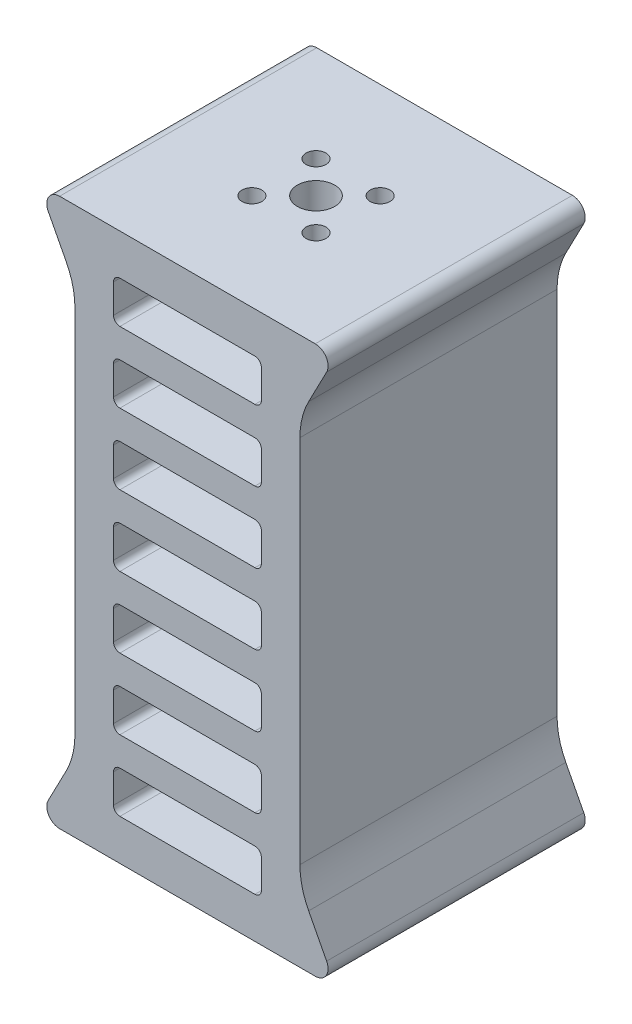
from build123d import *

# Parameters (mm, degrees)
BOSS_EXTRUDE1_DEPTH      = 20
BOSS_EXTRUDE1_DEPTH_BACK = 20
SKETCH1_W                = 35
SKETCH1_H                = 85.2
CUT_EXTRUDE2_REACH       = 91.478
SKETCH5_R                = 1.55
SKETCH5_R_2              = 2.9
CUT_EXTRUDE3_DEPTH       = 8
BOSS_EXTRUDE2_DEPTH      = 40


with BuildPart() as part:
    # Sketch1 → Boss-Extrude1 (new, two sides: drawn at the far end of the back side and taken through both)
    with BuildSketch(Plane.XY.offset(-BOSS_EXTRUDE1_DEPTH_BACK)):
        with Locations((1.938408795, -35.043181818)):
            Rectangle(SKETCH1_W, SKETCH1_H)
    extrude(amount=BOSS_EXTRUDE1_DEPTH + BOSS_EXTRUDE1_DEPTH_BACK)

    # Sketch2 → Cut-Extrude2 (cut, up to next)
    with BuildSketch(Plane.XY.offset(20), mode=Mode.PRIVATE) as cut_extrude2_sk1:
        with BuildLine():
            Line((-9.561591205, -10.793181818), (-9.561591205, -15.293181818))
            ThreePointArc((-9.561591205, -15.293181818), (-9.268697986, -16.000288599), (-8.561591205, -16.293181818))
            Line((-8.561591205, -16.293181818), (12.438408795, -16.293181818))
            ThreePointArc((12.438408795, -16.293181818), (13.145515577, -16.000288599), (13.438408795, -15.293181818))
            Line((13.438408795, -15.293181818), (13.438408795, -10.793181818))
            ThreePointArc((13.438408795, -10.793181818), (13.145515577, -10.086075037), (12.438408795, -9.793181818))
            Line((12.438408795, -9.793181818), (-8.561591205, -9.793181818))
            ThreePointArc((-8.561591205, -9.793181818), (-9.268697986, -10.086075037), (-9.561591205, -10.793181818))
        make_face()
    cut_extrude2_tool1 = extrude(cut_extrude2_sk1.sketch, amount=-CUT_EXTRUDE2_REACH, mode=Mode.PRIVATE) & part.part
    # Sketch2 → Cut-Extrude2 (cut, up to next)
    with BuildSketch(Plane.XY.offset(20), mode=Mode.PRIVATE) as cut_extrude2_sk2:
        with BuildLine():
            Line((-9.561591205, -21.793181818), (-9.561591205, -26.293181818))
            ThreePointArc((-9.561591205, -26.293181818), (-9.268697986, -27.000288599), (-8.561591205, -27.293181818))
            Line((-8.561591205, -27.293181818), (12.438408795, -27.293181818))
            ThreePointArc((12.438408795, -27.293181818), (13.145515577, -27.000288599), (13.438408795, -26.293181818))
            Line((13.438408795, -26.293181818), (13.438408795, -21.793181818))
            ThreePointArc((13.438408795, -21.793181818), (13.145515577, -21.086075037), (12.438408795, -20.793181818))
            Line((12.438408795, -20.793181818), (-8.561591205, -20.793181818))
            ThreePointArc((-8.561591205, -20.793181818), (-9.268697986, -21.086075037), (-9.561591205, -21.793181818))
        make_face()
    cut_extrude2_tool2 = extrude(cut_extrude2_sk2.sketch, amount=-CUT_EXTRUDE2_REACH, mode=Mode.PRIVATE) & part.part
    # Sketch2 → Cut-Extrude2 (cut, up to next)
    with BuildSketch(Plane.XY.offset(20), mode=Mode.PRIVATE) as cut_extrude2_sk3:
        with BuildLine():
            Line((-8.561591205, 1.206818182), (12.438408795, 1.206818182))
            ThreePointArc((12.438408795, 1.206818182), (13.145515577, 0.913924963), (13.438408795, 0.206818182))
            Line((13.438408795, 0.206818182), (13.438408795, -4.293181818))
            ThreePointArc((13.438408795, -4.293181818), (13.145515577, -5.000288599), (12.438408795, -5.293181818))
            Line((12.438408795, -5.293181818), (-8.561591205, -5.293181818))
            ThreePointArc((-8.561591205, -5.293181818), (-9.268697986, -5.000288599), (-9.561591205, -4.293181818))
            Line((-9.561591205, -4.293181818), (-9.561591205, 0.206818182))
            ThreePointArc((-9.561591205, 0.206818182), (-9.268697986, 0.913924963), (-8.561591205, 1.206818182))
        make_face()
    cut_extrude2_tool3 = extrude(cut_extrude2_sk3.sketch, amount=-CUT_EXTRUDE2_REACH, mode=Mode.PRIVATE) & part.part
    # Sketch2 → Cut-Extrude2 (cut, up to next)
    with BuildSketch(Plane.XY.offset(20), mode=Mode.PRIVATE) as cut_extrude2_sk4:
        with BuildLine():
            Line((-9.561591205, -32.793181818), (-9.561591205, -37.293181818))
            ThreePointArc((-9.561591205, -37.293181818), (-9.268697986, -38.000288599), (-8.561591205, -38.293181818))
            Line((-8.561591205, -38.293181818), (12.438408795, -38.293181818))
            ThreePointArc((12.438408795, -38.293181818), (13.145515577, -38.000288599), (13.438408795, -37.293181818))
            Line((13.438408795, -37.293181818), (13.438408795, -32.793181818))
            ThreePointArc((13.438408795, -32.793181818), (13.145515577, -32.086075037), (12.438408795, -31.793181818))
            Line((12.438408795, -31.793181818), (-8.561591205, -31.793181818))
            ThreePointArc((-8.561591205, -31.793181818), (-9.268697986, -32.086075037), (-9.561591205, -32.793181818))
        make_face()
    cut_extrude2_tool4 = extrude(cut_extrude2_sk4.sketch, amount=-CUT_EXTRUDE2_REACH, mode=Mode.PRIVATE) & part.part
    # Sketch2 → Cut-Extrude2 (cut, up to next)
    with BuildSketch(Plane.XY.offset(20), mode=Mode.PRIVATE) as cut_extrude2_sk5:
        with BuildLine():
            Line((-9.561591205, -43.793181818), (-9.561591205, -48.293181818))
            ThreePointArc((-9.561591205, -48.293181818), (-9.268697986, -49.000288599), (-8.561591205, -49.293181818))
            Line((-8.561591205, -49.293181818), (12.438408795, -49.293181818))
            ThreePointArc((12.438408795, -49.293181818), (13.145515577, -49.000288599), (13.438408795, -48.293181818))
            Line((13.438408795, -48.293181818), (13.438408795, -43.793181818))
            ThreePointArc((13.438408795, -43.793181818), (13.145515577, -43.086075037), (12.438408795, -42.793181818))
            Line((12.438408795, -42.793181818), (-8.561591205, -42.793181818))
            ThreePointArc((-8.561591205, -42.793181818), (-9.268697986, -43.086075037), (-9.561591205, -43.793181818))
        make_face()
    cut_extrude2_tool5 = extrude(cut_extrude2_sk5.sketch, amount=-CUT_EXTRUDE2_REACH, mode=Mode.PRIVATE) & part.part
    # Sketch2 → Cut-Extrude2 (cut, up to next)
    with BuildSketch(Plane.XY.offset(20), mode=Mode.PRIVATE) as cut_extrude2_sk6:
        with BuildLine():
            Line((-9.561591205, -54.793181818), (-9.561591205, -59.293181818))
            ThreePointArc((-9.561591205, -59.293181818), (-9.268697986, -60.000288599), (-8.561591205, -60.293181818))
            Line((-8.561591205, -60.293181818), (12.438408795, -60.293181818))
            ThreePointArc((12.438408795, -60.293181818), (13.145515577, -60.000288599), (13.438408795, -59.293181818))
            Line((13.438408795, -59.293181818), (13.438408795, -54.793181818))
            ThreePointArc((13.438408795, -54.793181818), (13.145515577, -54.086075037), (12.438408795, -53.793181818))
            Line((12.438408795, -53.793181818), (-8.561591205, -53.793181818))
            ThreePointArc((-8.561591205, -53.793181818), (-9.268697986, -54.086075037), (-9.561591205, -54.793181818))
        make_face()
    cut_extrude2_tool6 = extrude(cut_extrude2_sk6.sketch, amount=-CUT_EXTRUDE2_REACH, mode=Mode.PRIVATE) & part.part
    # Sketch2 → Cut-Extrude2 (cut, up to next)
    with BuildSketch(Plane.XY.offset(20), mode=Mode.PRIVATE) as cut_extrude2_sk7:
        with BuildLine():
            Line((-9.561591205, -65.793181818), (-9.561591205, -70.293181818))
            ThreePointArc((-9.561591205, -70.293181818), (-9.268697986, -71.000288599), (-8.561591205, -71.293181818))
            Line((-8.561591205, -71.293181818), (12.438408795, -71.293181818))
            ThreePointArc((12.438408795, -71.293181818), (13.145515577, -71.000288599), (13.438408795, -70.293181818))
            Line((13.438408795, -70.293181818), (13.438408795, -65.793181818))
            ThreePointArc((13.438408795, -65.793181818), (13.145515577, -65.086075037), (12.438408795, -64.793181818))
            Line((12.438408795, -64.793181818), (-8.561591205, -64.793181818))
            ThreePointArc((-8.561591205, -64.793181818), (-9.268697986, -65.086075037), (-9.561591205, -65.793181818))
        make_face()
    cut_extrude2_tool7 = extrude(cut_extrude2_sk7.sketch, amount=-CUT_EXTRUDE2_REACH, mode=Mode.PRIVATE) & part.part
    add(cut_extrude2_tool1.solids().sort_by_distance((1.938409, -13.043182, 20))[0], mode=Mode.SUBTRACT)
    add(cut_extrude2_tool2.solids().sort_by_distance((1.938409, -24.043182, 20))[0], mode=Mode.SUBTRACT)
    add(cut_extrude2_tool3.solids().sort_by_distance((1.938409, -2.043182, 20))[0], mode=Mode.SUBTRACT)
    add(cut_extrude2_tool4.solids().sort_by_distance((1.938409, -35.043182, 20))[0], mode=Mode.SUBTRACT)
    add(cut_extrude2_tool5.solids().sort_by_distance((1.938409, -46.043182, 20))[0], mode=Mode.SUBTRACT)
    add(cut_extrude2_tool6.solids().sort_by_distance((1.938409, -57.043182, 20))[0], mode=Mode.SUBTRACT)
    add(cut_extrude2_tool7.solids().sort_by_distance((1.938409, -68.043182, 20))[0], mode=Mode.SUBTRACT)

    # Sketch5 → Cut-Extrude3 (cut)
    with BuildSketch(Plane(origin=(0, 7.556818182, 0), x_dir=(1, 0, 0), z_dir=(0, 1, 0))):
        with Locations(Location((-3.046694012, 4.985102807, 0), (0, 0, 270))):
            Circle(SKETCH5_R)
        with Locations(Location((1.938408795, 0, 0), (0, 0, 270))):
            Circle(SKETCH5_R_2)
        with Locations(Location((6.923511603, 4.985102807, 0), (0, 0, 270))):
            Circle(SKETCH5_R)
        with Locations(Location((6.923511603, -4.985102807, 0), (0, 0, 270))):
            Circle(SKETCH5_R)
        with Locations(Location((-3.046694012, -4.985102807, 0), (0, 0, 270))):
            Circle(SKETCH5_R)
    cut_extrude3 = extrude(amount=-CUT_EXTRUDE3_DEPTH, mode=Mode.SUBTRACT)

    # Mirror3: Cut-Extrude3 across plane
    add(cut_extrude3.mirror(Plane.ZX.offset(-35.043181818)), mode=Mode.SUBTRACT)

    # Sketch7 → Boss-Extrude2 (add)
    with BuildSketch(Plane(origin=(0, 0, -20), x_dir=(-1, 0, 0), z_dir=(0, 0, -1))):
        with BuildLine():
            Line((-19.438408795, 7.556818182), (-21.818320385, 7.556818182))
            ThreePointArc((-21.818320385, 7.556818182), (-23.528170709, 6.594320889), (-23.592294725, 4.633230049))
            Line((-23.592294725, 4.633230049), (-20.794562752, -0.740490723))
            ThreePointArc((-20.794562752, -0.740490723), (-19.782377041, -3.429490161), (-19.438408795, -6.282019519))
            Line((-19.438408795, -6.282019519), (-19.438408795, 7.556818182))
        make_face()
        with BuildLine():
            Line((15.561591205, -77.643181818), (17.941502794, -77.643181818))
            ThreePointArc((17.941502794, -77.643181818), (19.651353118, -76.680684525), (19.715477134, -74.719593686))
            Line((19.715477134, -74.719593686), (16.917745161, -69.345872913))
            ThreePointArc((16.917745161, -69.345872913), (15.90555945, -66.656873475), (15.561591205, -63.804344117))
            Line((15.561591205, -63.804344117), (15.561591205, -77.643181818))
        make_face()
        with BuildLine():
            Line((-19.438408795, -63.804344117), (-19.438408795, -77.643181818))
            Line((-19.438408795, -77.643181818), (-21.818320385, -77.643181818))
            ThreePointArc((-21.818320385, -77.643181818), (-23.528170709, -76.680684525), (-23.592294725, -74.719593686))
            Line((-23.592294725, -74.719593686), (-20.794562752, -69.345872913))
            ThreePointArc((-20.794562752, -69.345872913), (-19.782377041, -66.656873475), (-19.438408795, -63.804344117))
        make_face()
        with BuildLine():
            Line((15.561591205, -6.282019519), (15.561591205, 7.556818182))
            Line((15.561591205, 7.556818182), (17.941502794, 7.556818182))
            ThreePointArc((17.941502794, 7.556818182), (19.651353118, 6.594320889), (19.715477134, 4.633230049))
            Line((19.715477134, 4.633230049), (16.917745161, -0.740490723))
            ThreePointArc((16.917745161, -0.740490723), (15.90555945, -3.429490161), (15.561591205, -6.282019519))
        make_face()
    extrude(amount=-BOSS_EXTRUDE2_DEPTH)


solid = part.part
